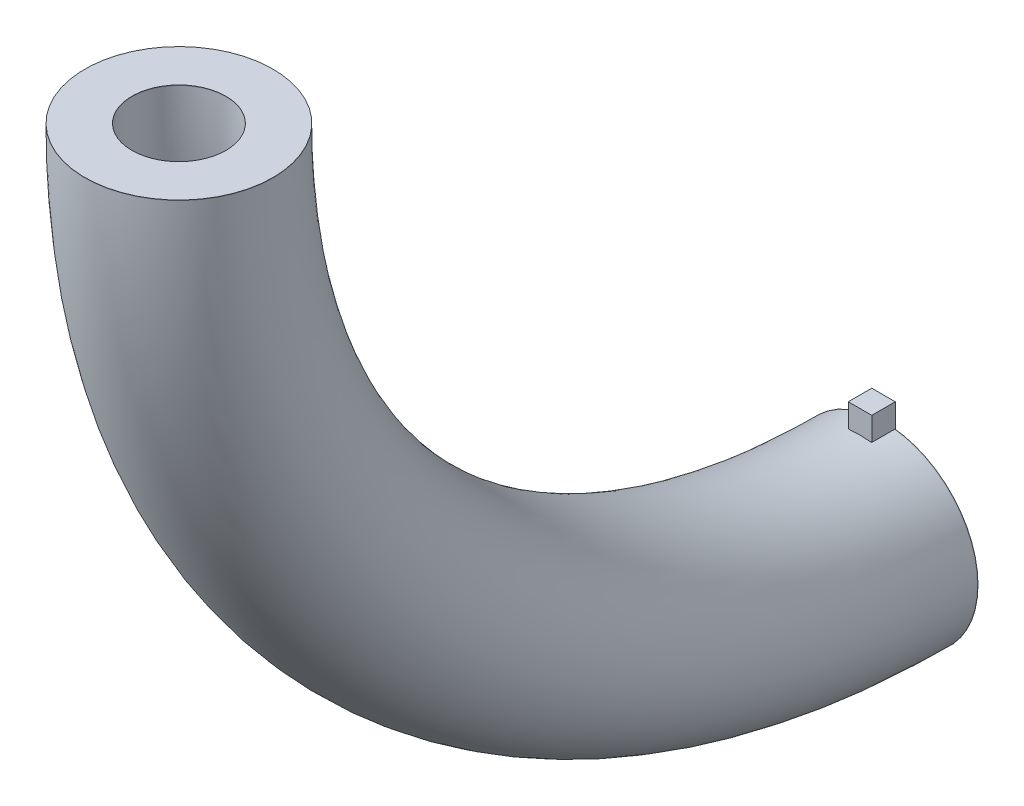
from build123d import *

# Parameters (mm, degrees)
SKETCH1_R           = 2
SKETCH1_R_2         = 1
SKETCH3_W           = 0.5
SKETCH3_H           = 0.5
BOSS_EXTRUDE1_DEPTH = 0.25


with BuildPart() as part:
    # Sweep1: sweep along a path in Sketch2
    with BuildLine(Plane(origin=(0, 0, 0), x_dir=(0, 0, -1), z_dir=(1, 0, 0))) as sweep1_path:
        Line((0, 0), (-0.01, 0))
        ThreePointArc((-0.01, 0), (-10.60953065, 4.39046935), (-15, 14.99))
        Line((-15, 14.99), (-15, 15))
    # Sketch1 → Sweep1 (sweep)
    with BuildSketch(Plane.XY):
        Circle(SKETCH1_R)
        Circle(SKETCH1_R_2, mode=Mode.SUBTRACT)
    sweep(path=sweep1_path.line)

    # Sketch3 → Boss-Extrude1 (add, symmetric)
    with BuildSketch(Plane(origin=(0, 0, 0), x_dir=(0, 0, -1), z_dir=(1, 0, 0))):
        with Locations((-0.26, 2.25)):
            Rectangle(SKETCH3_W, SKETCH3_H)
    extrude(amount=BOSS_EXTRUDE1_DEPTH, both=True)


solid = part.part
